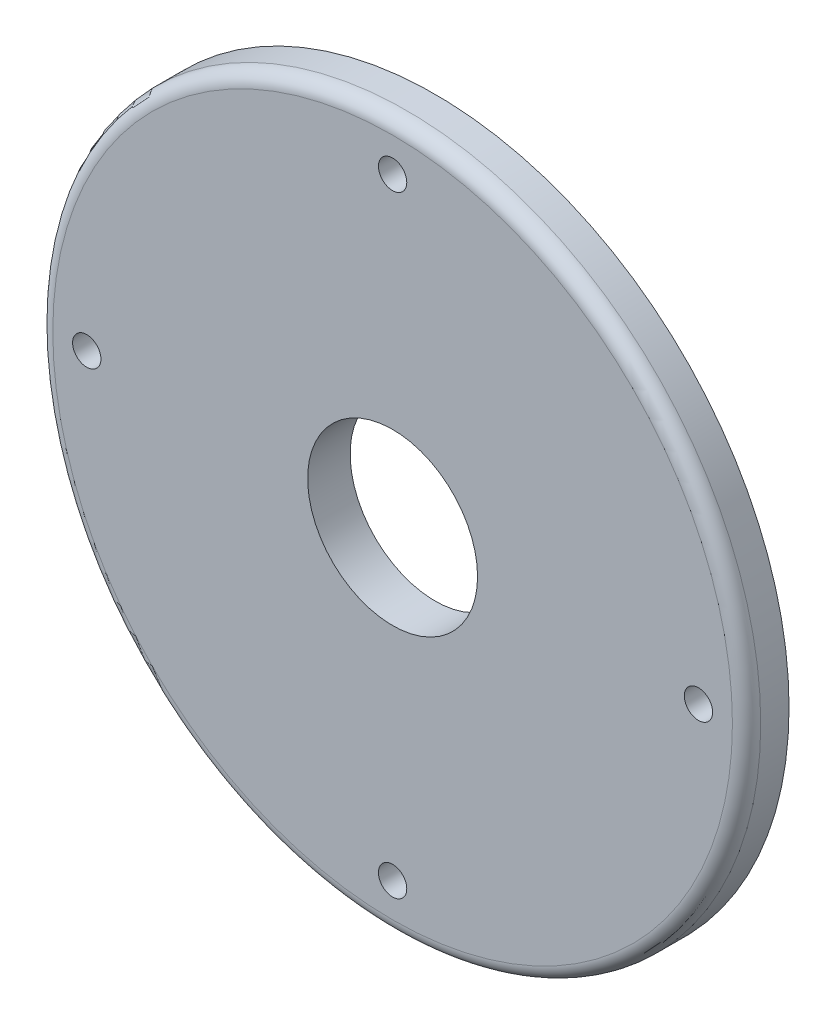
from build123d import *

# Parameters (mm, degrees)
SKETCH1_R           = 25
SKETCH1_R_2         = 6
SKETCH1_R_3         = 1
BOSS_EXTRUDE1_DEPTH = 3
FILLET1_R           = 1


with BuildPart() as part:
    # Sketch1 → Boss-Extrude1 (new body)
    with BuildSketch(Plane.XY.offset(1301.677843453)):
        with Locations((678.383867879, 875.198049015)):
            Circle(SKETCH1_R)
        with Locations((678.383867879, 875.198049015)):
            Circle(SKETCH1_R_2, mode=Mode.SUBTRACT)
        with Locations((678.383867879, 896.799115491)):
            Circle(SKETCH1_R_3, mode=Mode.SUBTRACT)
        with Locations((678.383867879, 853.59698254)):
            Circle(SKETCH1_R_3, mode=Mode.SUBTRACT)
        with Locations((699.984934354, 875.198049015)):
            Circle(SKETCH1_R_3, mode=Mode.SUBTRACT)
        with Locations((656.782801404, 875.198049015)):
            Circle(SKETCH1_R_3, mode=Mode.SUBTRACT)
    extrude(amount=BOSS_EXTRUDE1_DEPTH)

    # Fillet1
    fillet1_edges = [part.edges().sort_by_distance(p)[0] for p in [
        (653.383867879, 875.198049015, 1304.677843453),
    ]]
    fillet(fillet1_edges, radius=FILLET1_R)


solid = part.part
